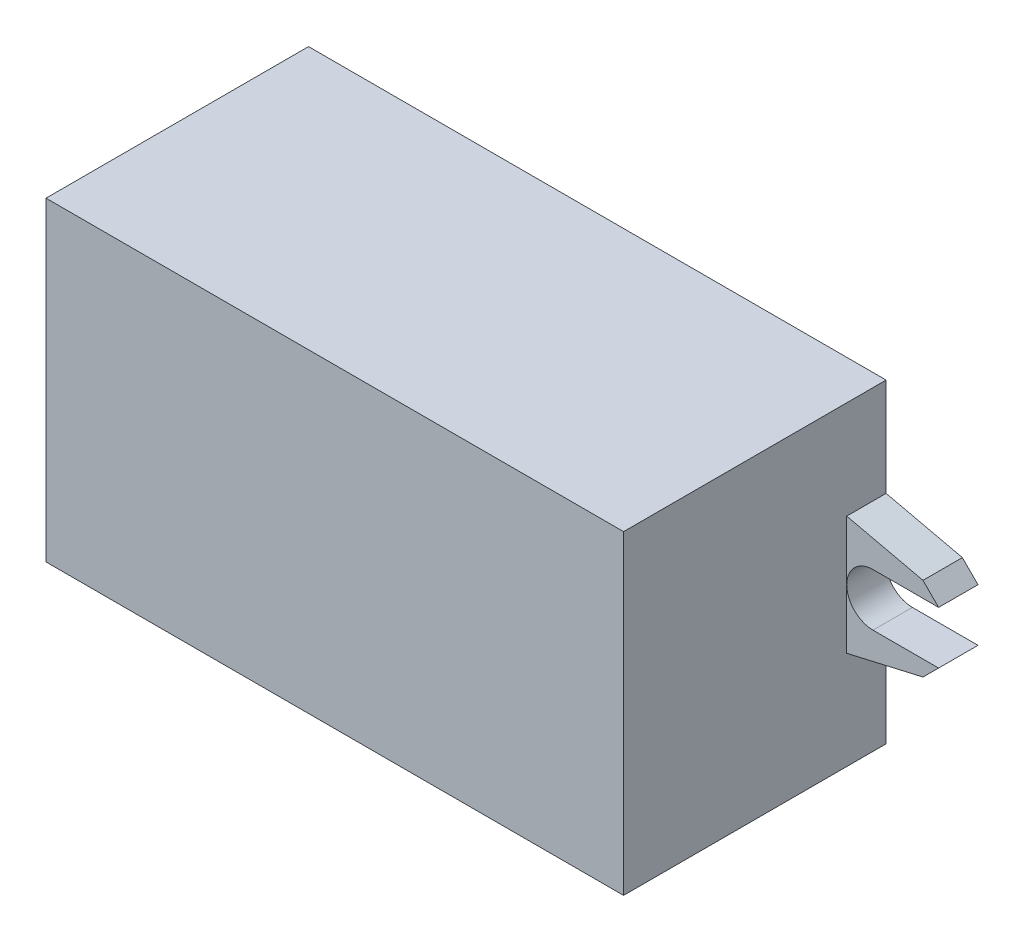
from build123d import *

# Parameters (mm, degrees)
SKETCH_1_W      = 44
SKETCH_1_H      = 24
EXTRUDE_1_DEPTH = 20
EXTRUDE_2_DEPTH = 3


with BuildPart() as part:
    # 草图1 → 凸台-拉伸1 (new body)
    with BuildSketch(Plane.XY):
        Rectangle(SKETCH_1_W, SKETCH_1_H)
    extrude(amount=EXTRUDE_1_DEPTH)

    # 草图2 → 凸台-拉伸2 (add)
    with BuildSketch(Plane(origin=(0, 0, 0), x_dir=(-1, 0, 0), z_dir=(0, 0, -1))):
        with BuildLine():
            Line((22, 4.523639819), (22, -1e-08))
            ThreePointArc((22, -1e-08), (22.585786434, 1.414213559), (24, 2))
            Line((24, 2), (29, 2))
            Line((29, 2), (27.809223998, 3.190776002))
            Line((27.809223998, 3.190776002), (22, 4.523639819))
        make_face()
        with BuildLine():
            Line((22, -4.523639819), (27.809223998, -3.190776002))
            Line((27.809223998, -3.190776002), (29, -2))
            Line((29, -2), (24, -2))
            ThreePointArc((24, -2), (22.585786441, -1.414213566), (22, -1e-08))
            Line((22, -1e-08), (22, -4.523639819))
        make_face()
        with BuildLine():
            Line((-27.809223998, 3.190776002), (-29, 2))
            Line((-29, 2), (-24, 2))
            ThreePointArc((-24, 2), (-22.585786447, 1.414213572), (-22, 2.8e-08))
            Line((-22, 2.8e-08), (-22, 4.523639819))
            Line((-22, 4.523639819), (-27.809223998, 3.190776002))
        make_face()
        with BuildLine():
            Line((-22, -4.523639819), (-22, 2.8e-08))
            ThreePointArc((-22, 2.8e-08), (-22.585786428, -1.414213553), (-24, -2))
            Line((-24, -2), (-29, -2))
            Line((-29, -2), (-27.809223998, -3.190776002))
            Line((-27.809223998, -3.190776002), (-22, -4.523639819))
        make_face()
    extrude(amount=-EXTRUDE_2_DEPTH)


solid = part.part
